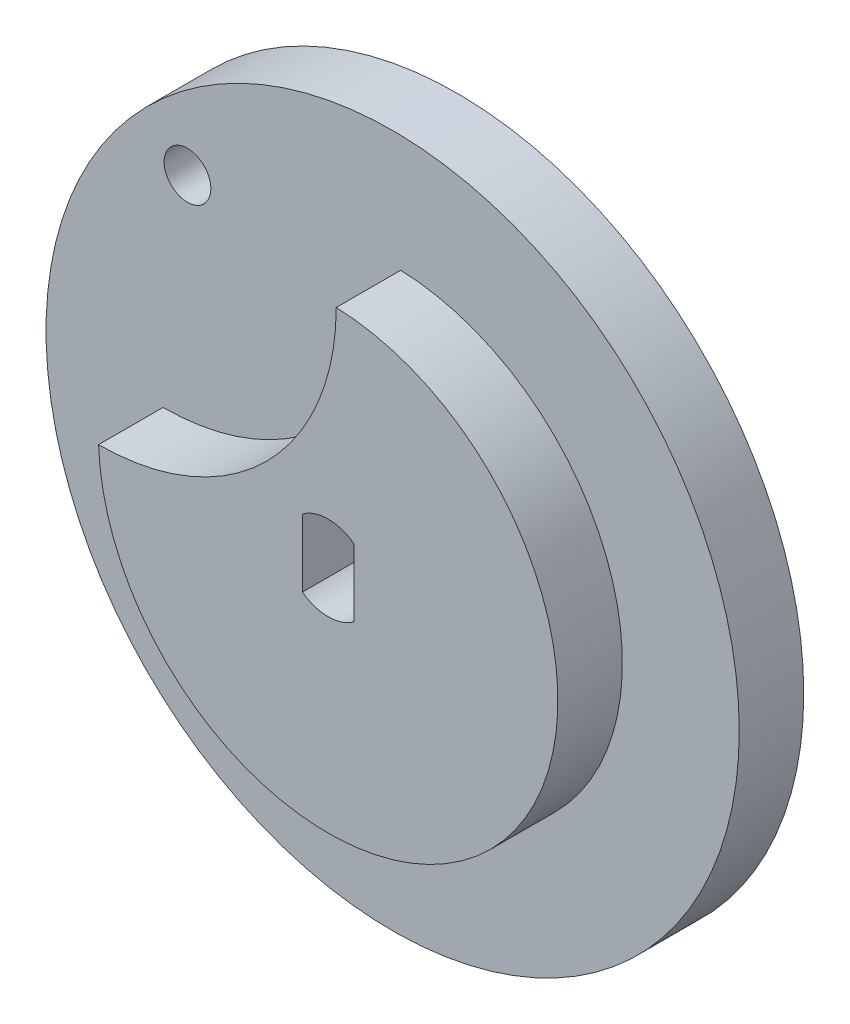
from build123d import *

# Parameters (mm, degrees)
SKETCH4_R           = 21.5
SKETCH4_R_2         = 1.45
BOSS_EXTRUDE1_DEPTH = 4
BOSS_EXTRUDE2_DEPTH = 4
CUT_EXTRUDE1_DEPTH  = 1.5


with BuildPart() as part:
    # Sketch4 → Boss-Extrude1 (new body)
    with BuildSketch(Plane.XY):
        Circle(SKETCH4_R)
        with Locations((-12.727922061, 12.727922061)):
            Circle(SKETCH4_R_2, mode=Mode.SUBTRACT)
        with BuildLine():
            Line((-1.6, -2.1), (-1.6, 2.1))
            ThreePointArc((-1.6, 2.1), (0, 2.625143683), (1.6, 2.1))
            Line((1.6, 2.1), (1.6, -2.1))
            ThreePointArc((1.6, -2.1), (0, -2.625143683), (-1.6, -2.1))
        make_face(mode=Mode.SUBTRACT)
    extrude(amount=BOSS_EXTRUDE1_DEPTH)

    # Sketch5 → Boss-Extrude2 (add)
    with BuildSketch(Plane.XY.offset(4)):
        with BuildLine():
            ThreePointArc((-14.24122807, -0.499923047), (10.076271632, -10.076271632), (0.499923047, 14.24122807))
            ThreePointArc((0.499923047, 14.24122807), (-3.820227547, 3.820227547), (-14.24122807, -0.499923047))
        make_face()
        with BuildLine():
            Line((1.6, -2.1), (1.6, 2.1))
            ThreePointArc((1.6, 2.1), (0, 2.625143683), (-1.6, 2.1))
            Line((-1.6, 2.1), (-1.6, -2.1))
            ThreePointArc((-1.6, -2.1), (0, -2.625143683), (1.6, -2.1))
        make_face(mode=Mode.SUBTRACT)
    extrude(amount=BOSS_EXTRUDE2_DEPTH)

    # Sketch7 → Cut-Extrude1 (cut)
    with BuildSketch(Plane(origin=(0, 0, 0), x_dir=(-1, 0, 0), z_dir=(0, 0, -1))):
        with BuildLine():
            Line((-1.6, -2.081196616), (-1.6, 2.081196616))
            ThreePointArc((-1.6, 2.081196616), (-2.625143683, 0), (-1.6, -2.081196616))
        make_face()
        with BuildLine():
            ThreePointArc((2.625143683, 0), (2.354953211, 1.159989108), (1.6, 2.081196616))
            Line((1.6, 2.081196616), (1.6, -2.081196616))
            ThreePointArc((1.6, -2.081196616), (2.354953211, -1.159989108), (2.625143683, 0))
        make_face()
    extrude(amount=-CUT_EXTRUDE1_DEPTH, mode=Mode.SUBTRACT)


solid = part.part
